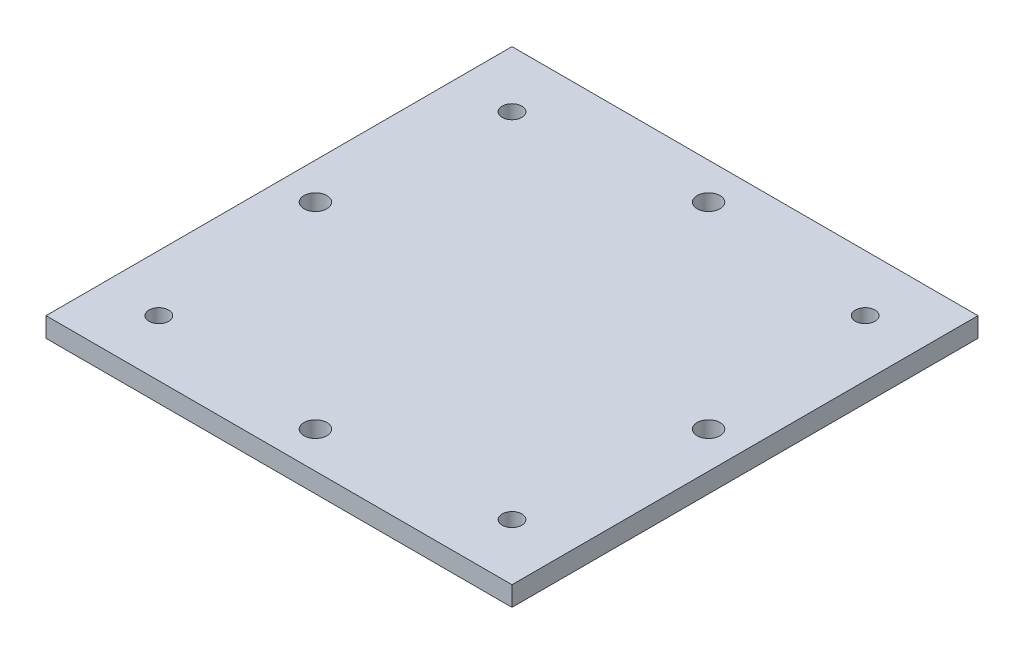
from build123d import *

# Parameters (mm, degrees)
SKETCH2_W           = 71.12
SKETCH2_H           = 71.12
SKETCH2_R           = 1.7526
SKETCH2_R_2         = 1.500000048
BOSS_EXTRUDE1_DEPTH = 3


with BuildPart() as part:
    # Sketch2 → Boss-Extrude1 (new body)
    with BuildSketch(Plane(origin=(0, 0, 0), x_dir=(1, 0, 0), z_dir=(0, 1, 0))):
        Rectangle(SKETCH2_W, SKETCH2_H)
        with Locations(Location((0, 30, 0), (0, 0, 270))):
            Circle(SKETCH2_R, mode=Mode.SUBTRACT)
        with Locations(Location((-30, 0, 0), (0, 0, 270))):
            Circle(SKETCH2_R, mode=Mode.SUBTRACT)
        with Locations(Location((30, 0, 0), (0, 0, 270))):
            Circle(SKETCH2_R, mode=Mode.SUBTRACT)
        with Locations(Location((0, -30, 0), (0, 0, 270))):
            Circle(SKETCH2_R, mode=Mode.SUBTRACT)
        with Locations(Location((26.9494, 26.9494, 0), (0, 0, 270))):
            Circle(SKETCH2_R_2, mode=Mode.SUBTRACT)
        with Locations(Location((-26.9494, 26.9494, 0), (0, 0, 270))):
            Circle(SKETCH2_R_2, mode=Mode.SUBTRACT)
        with Locations(Location((26.9494, -26.9494, 0), (0, 0, 270))):
            Circle(SKETCH2_R_2, mode=Mode.SUBTRACT)
        with Locations(Location((-26.9494, -26.9494, 0), (0, 0, 270))):
            Circle(SKETCH2_R_2, mode=Mode.SUBTRACT)
    extrude(amount=BOSS_EXTRUDE1_DEPTH)


solid = part.part
